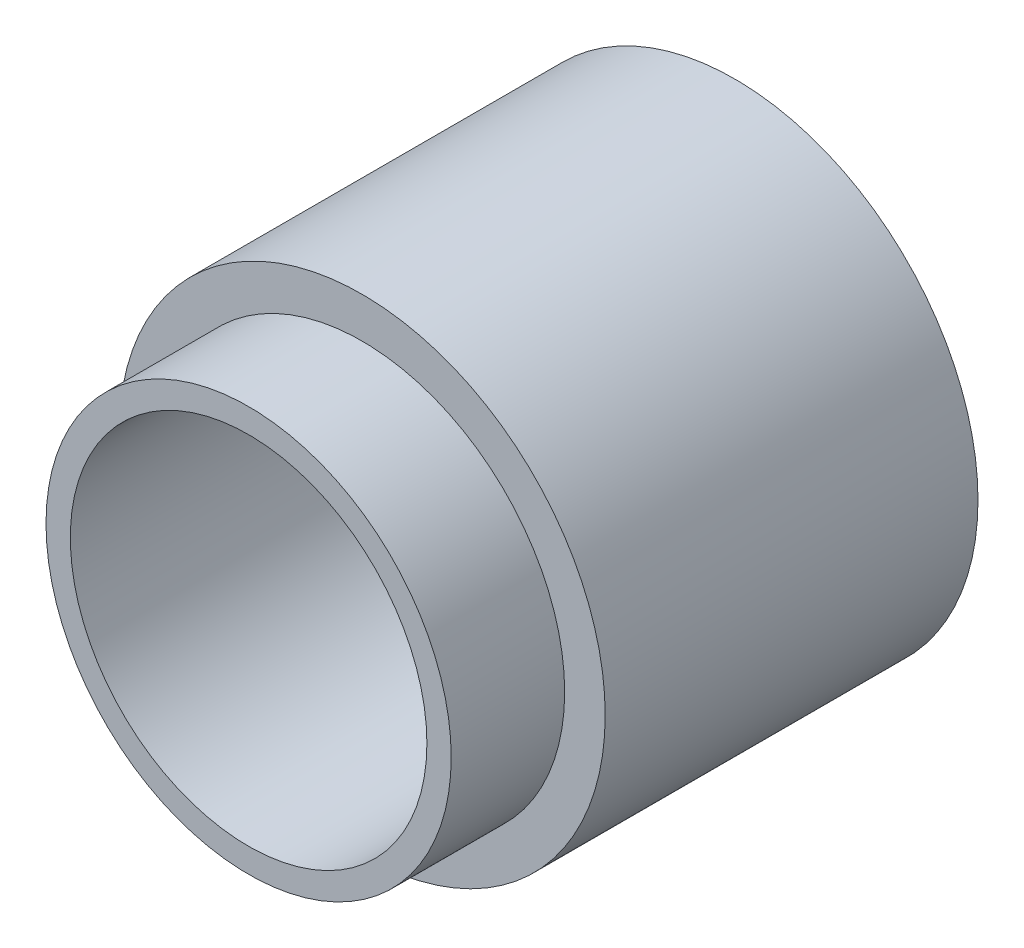
from build123d import *

# Parameters (mm, degrees)
SKETCH1_R           = 12.5
SKETCH1_R_2         = 11
BOSS_EXTRUDE1_DEPTH = 30
BOSS_EXTRUDE2_START = -30
SKETCH2_R           = 15
SKETCH2_R_2         = 12.5
BOSS_EXTRUDE2_DEPTH = 23


with BuildPart() as part:
    # Sketch1 → Boss-Extrude1 (new body)
    with BuildSketch(Plane.XY):
        Circle(SKETCH1_R)
        Circle(SKETCH1_R_2, mode=Mode.SUBTRACT)
    extrude(amount=BOSS_EXTRUDE1_DEPTH)

    # Sketch2 → Boss-Extrude2 (add)
    with BuildSketch(Plane.XY.offset(30).offset(BOSS_EXTRUDE2_START)):
        Circle(SKETCH2_R)
        Circle(SKETCH2_R_2, mode=Mode.SUBTRACT)
    extrude(amount=BOSS_EXTRUDE2_DEPTH)


solid = part.part
